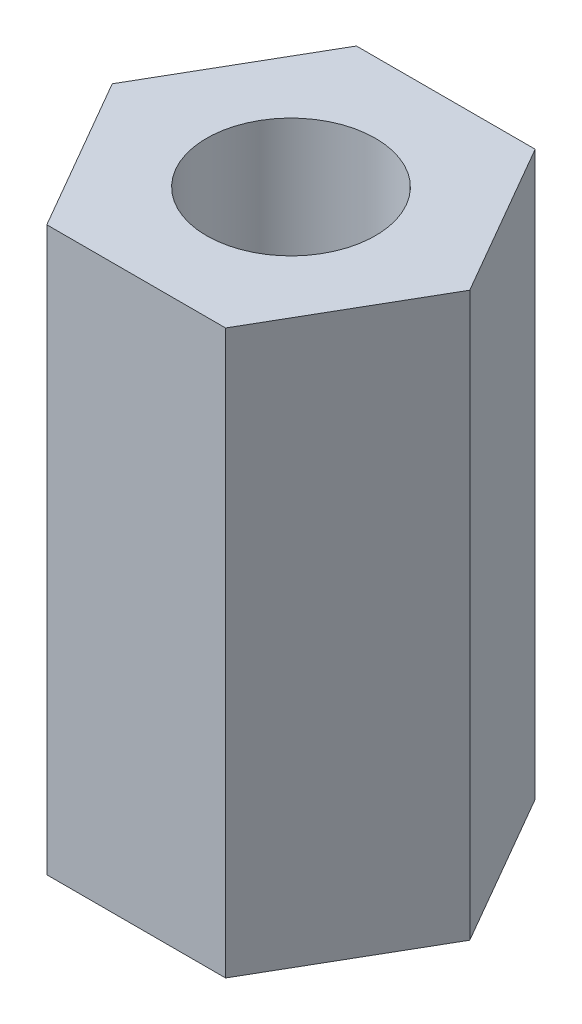
from build123d import *

# Parameters (mm, degrees)
SKETCH_1_R      = 1.5
EXTRUDE_1_DEPTH = 10


with BuildPart() as part:
    # 草图1 → 凸台-拉伸1 (new body)
    with BuildSketch(Plane(origin=(0, 0, 0), x_dir=(1, 0, 0), z_dir=(0, 1, 0))):
        Polygon((2.855422262, 0), (1.267709021, 2.75), (-1.907717459, 2.75), (-3.4954307, 0), (-1.907717459, -2.75), (1.267709021, -2.75), align=None)
        with Locations(Location((-0.320004219, 0, 0), (0, 0, 270))):
            Circle(SKETCH_1_R, mode=Mode.SUBTRACT)
    extrude(amount=EXTRUDE_1_DEPTH)


solid = part.part
